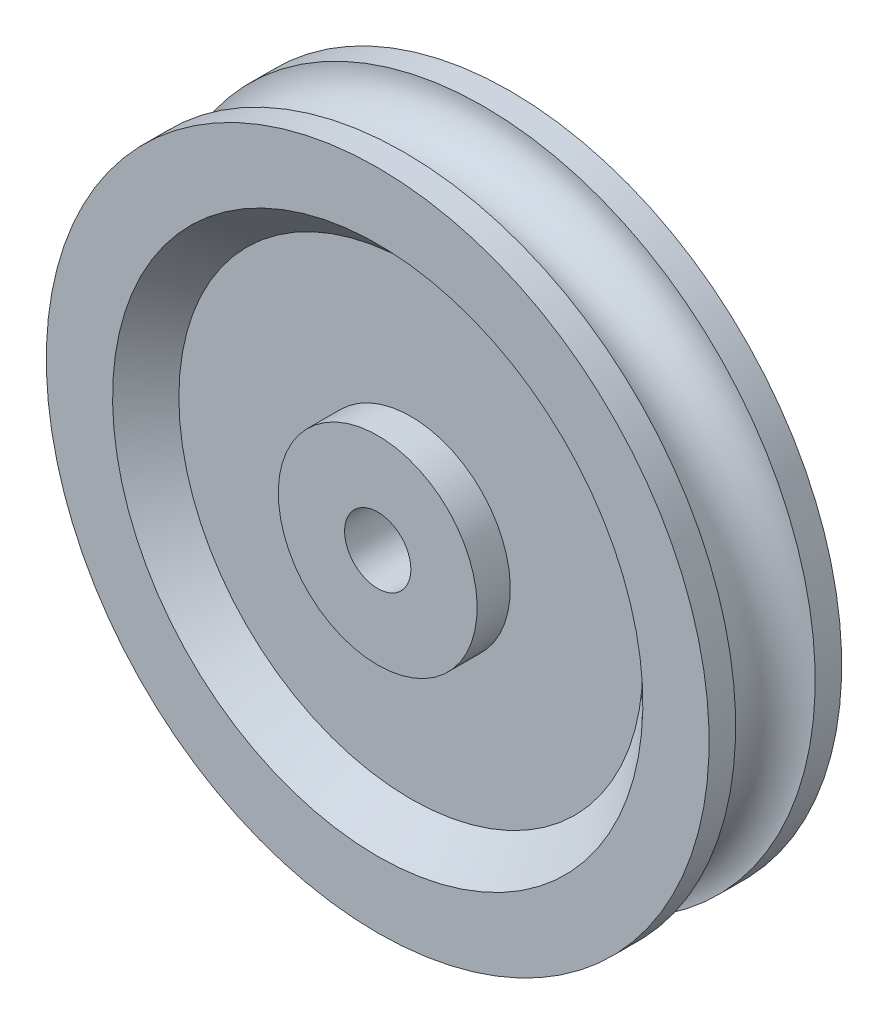
from build123d import *

# Parameters (mm, degrees)
SKETCH_2_R          = 5
CUT_EXTRUDE_1_DEPTH = 74.484692283


with BuildPart() as part:
    # Эскиз1 → Повернуть1 (revolve)
    with BuildSketch(Plane(origin=(0, 0, 0), x_dir=(0, 0, -1), z_dir=(1, 0, 0)), mode=Mode.PRIVATE) as revolve_1_sk:
        with BuildLine():
            Line((6, 50), (10, 50))
            Line((10, 50), (10, 40))
            Line((10, 40), (5, 35))
            Line((5, 35), (5, 15))
            Line((5, 15), (10, 15))
            Line((10, 15), (10, 0))
            Line((10, 0), (-10, 0))
            Line((-10, 0), (-10, 15))
            Line((-10, 15), (-5, 15))
            Line((-5, 15), (-5, 35))
            Line((-5, 35), (-10, 40))
            Line((-10, 40), (-10, 50))
            Line((-10, 50), (-6, 50))
            ThreePointArc((-6, 50), (0, 44), (6, 50))
        make_face()
    revolve(revolve_1_sk.sketch.rotate(Axis((0, 0, 10), (0, 0, -1)), 180), axis=Axis((0, 0, 10), (0, 0, -1)))

    # Эскиз2 → Вырез-Вытянуть1 (cut, through all)
    with BuildSketch(Plane.XY.offset(10)):
        Circle(SKETCH_2_R)
    extrude(amount=-CUT_EXTRUDE_1_DEPTH, mode=Mode.SUBTRACT)


solid = part.part
